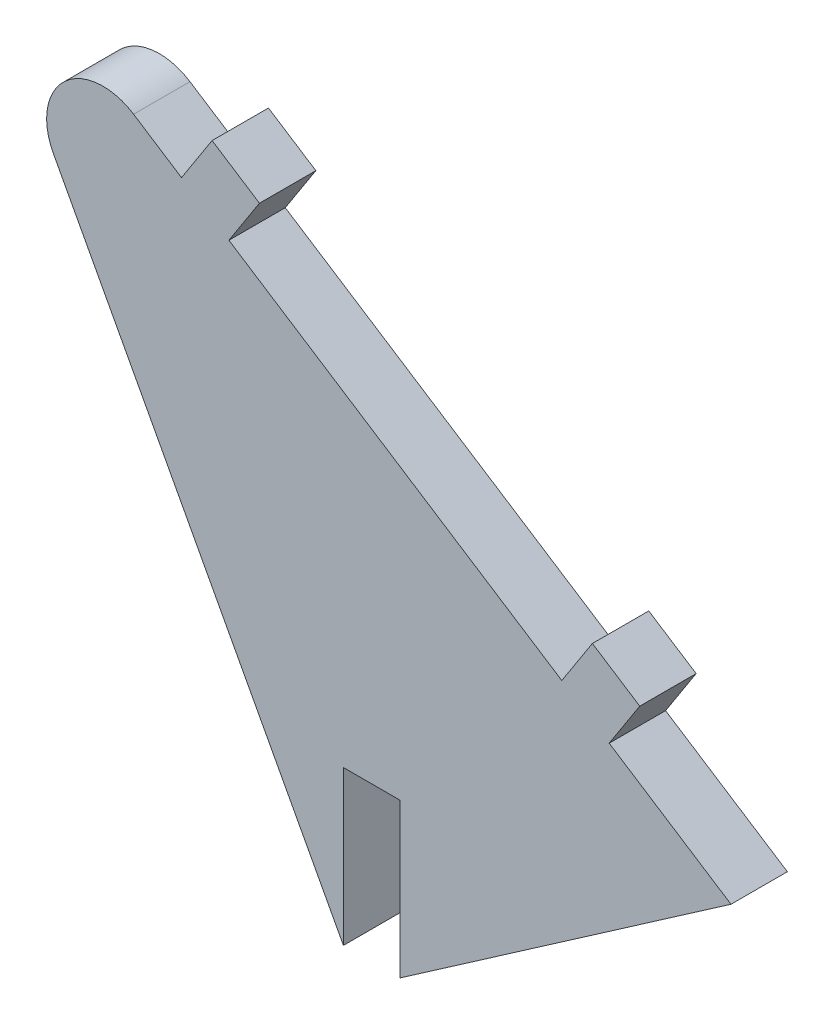
from build123d import *

# Parameters (mm, degrees)
BOSS_EXTRUDE1_DEPTH = 1.524
FILLET1_R           = 1.524


with BuildPart() as part:
    # Sketch1 → Boss-Extrude1 (new body)
    with BuildSketch(Plane.XY):
        Polygon((0, 73.143262765), (1.524, 73.143262765), (1.524, 68.978612676), (10.474816324, 75.179605793), (7.183025054, 77.303792749), (8.009350184, 78.584324974), (6.728817959, 79.410650105), (5.902492829, 78.13011788), (-3.0948828, 83.93610811), (-2.26855767, 85.216640335), (-3.549089895, 86.042965466), (-4.375415025, 84.762433241), (-10.628767588, 88.797710347), (0, 68.978612676), align=None)
    extrude(amount=BOSS_EXTRUDE1_DEPTH)

    # Fillet1
    fillet1_edges = [part.edges().sort_by_distance(p)[0] for p in [
        (-10.628767588, 88.797710347, 0.762),
    ]]
    fillet(fillet1_edges, radius=FILLET1_R)


solid = part.part
